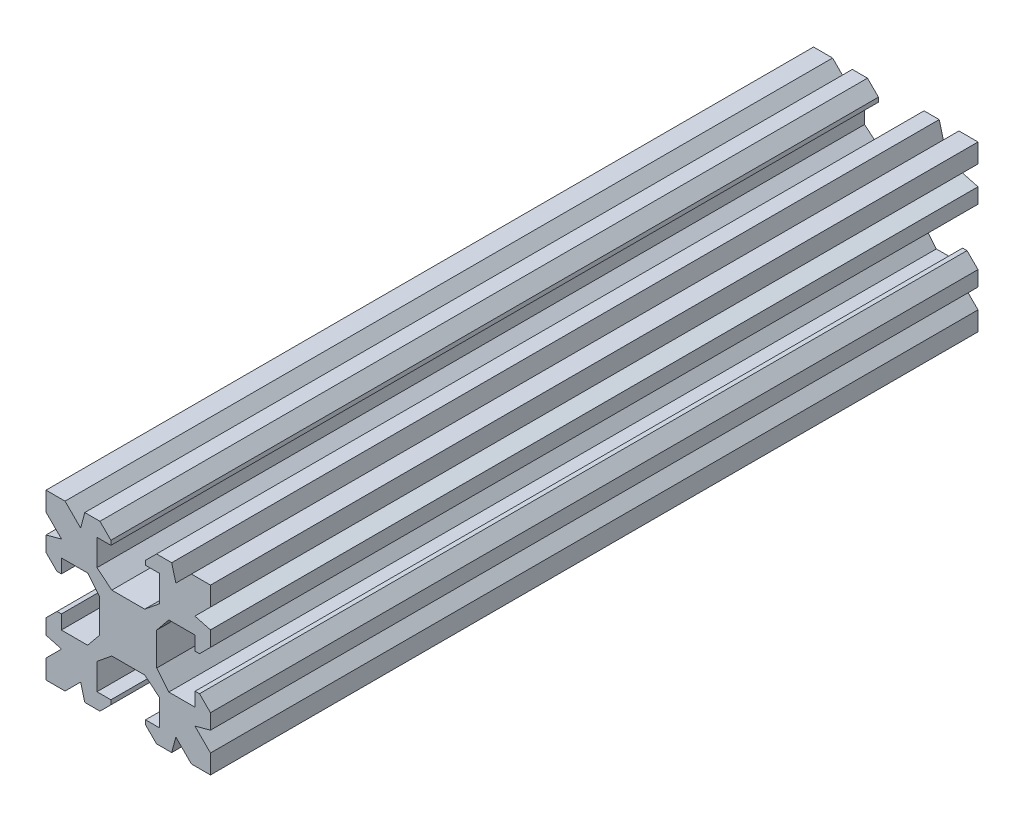
from build123d import *

# Parameters (mm, degrees)
EXTRUDE_1_DEPTH     = 70
CUT_EXTRUDE_1_DEPTH = 71.799011293
CHAMFER_1_SIZE      = 1


with BuildPart() as part:
    # Эскиз1 → Бобышка-Вытянуть1 (new body)
    with BuildSketch(Plane.XY):
        Polygon((1.58, 7.5), (1.58, 6.1), (2.85, 6.1), (2.85, 3.7), (-2.85, 3.7), (-2.85, 6.1), (-1.58, 6.1), (-1.58, 7.5), (-3.962017091, 7.5), (-4.342017091, 6.08), (-5.762017091, 7.5), (-7.5, 7.5), (-7.5, 5.762017091), (-6.08, 4.342017091), (-7.5, 3.962017091), (-7.5, 1.58), (-6.1, 1.58), (-6.1, 2.85), (-3.7, 2.85), (-3.7, -2.85), (-6.1, -2.85), (-6.1, -1.58), (-7.5, -1.58), (-7.5, -3.962017091), (-6.08, -4.342017091), (-7.5, -5.762017091), (-7.5, -7.5), (-5.762017091, -7.5), (-4.342017091, -6.08), (-3.962017091, -7.5), (-1.58, -7.5), (-1.58, -6.1), (-2.85, -6.1), (-2.85, -3.7), (2.85, -3.7), (2.85, -6.1), (1.58, -6.1), (1.58, -7.5), (3.962017091, -7.5), (4.342017091, -6.08), (5.762017091, -7.5), (7.5, -7.5), (7.5, -5.762017091), (6.08, -4.342017091), (7.5, -3.962017091), (7.5, -1.58), (6.1, -1.58), (6.1, -2.85), (3.7, -2.85), (3.7, 2.85), (6.1, 2.85), (6.1, 1.58), (7.5, 1.58), (7.5, 3.962017091), (6.08, 4.342017091), (7.5, 5.762017091), (7.5, 7.5), (5.762017091, 7.5), (4.342017091, 6.08), (3.962017091, 7.5), align=None)
    extrude(amount=EXTRUDE_1_DEPTH)

    # Эскиз2 → Вырез-Вытянуть1 (cut, through all)
    with BuildSketch(Plane.XY.offset(70)):
        Polygon((-3.7, 2.85), (-2.6, 1.5), (-2.6, -1.5), (-3.7, -2.85), align=None)
        Polygon((2.85, 3.7), (1.5, 2.6), (-1.5, 2.6), (-2.85, 3.7), align=None)
        Polygon((3.7, -2.85), (2.6, -1.5), (2.6, 1.5), (3.7, 2.85), align=None)
        Polygon((-2.85, -3.7), (-1.5, -2.6), (1.5, -2.6), (2.85, -3.7), align=None)
    extrude(amount=-CUT_EXTRUDE_1_DEPTH, mode=Mode.SUBTRACT)

    # Фаска1
    chamfer_1_edges = [part.edges().sort_by_distance(p)[0] for p in [
        (-7.5, -1.58, 35),
        (-7.5, 1.58, 35),
        (-1.58, 7.5, 35),
        (1.58, 7.5, 35),
        (7.5, 1.58, 35),
        (7.5, -1.58, 35),
        (1.58, -7.5, 35),
        (-1.58, -7.5, 35),
    ]]
    chamfer(chamfer_1_edges, length=CHAMFER_1_SIZE)


solid = part.part
